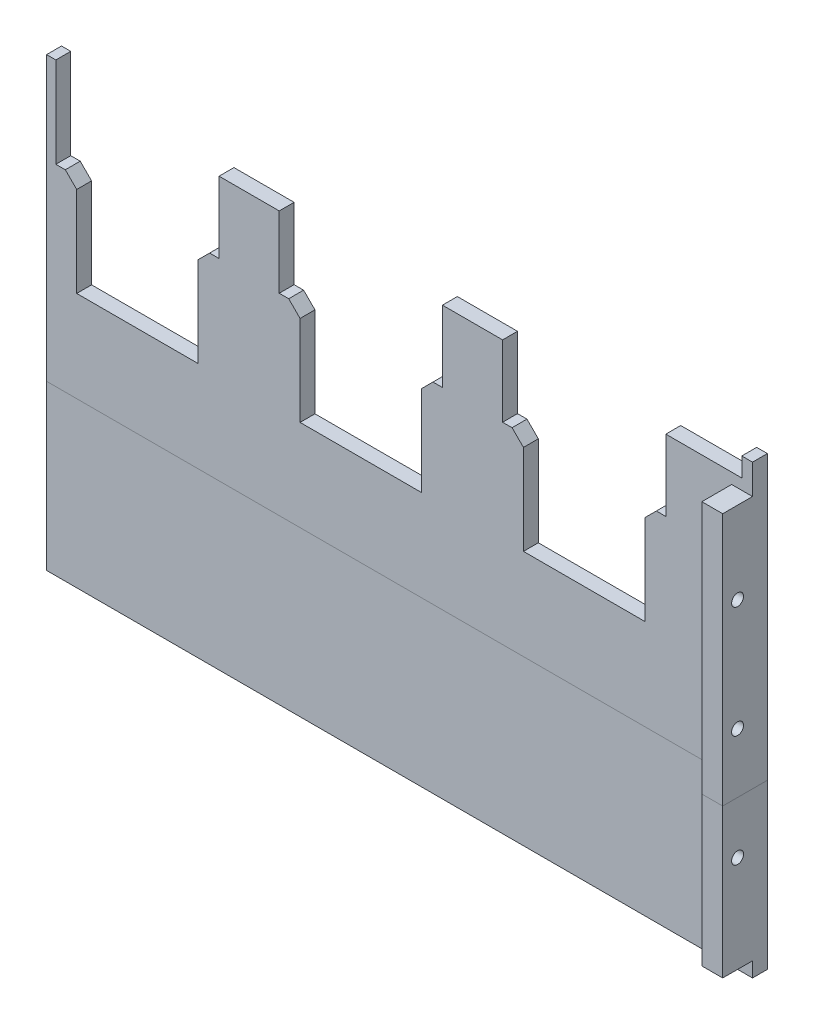
from build123d import *

# Parameters (mm, degrees)
SZKIC1_W                    = 237
SZKIC1_H                    = 150
DODANIE_WYCI_GNI_CIE1_DEPTH = 5
SZKIC2_W                    = 7
SZKIC2_H                    = 135
DODANIE_WYCI_GNI_CIE2_DEPTH = 10
OTW_R_4_0_4_1_D             = 4
OTW_R_4_0_4_1_DEPTH         = 6.7
WYTNIJ_WYCI_GNI_CIE1_REACH  = 143.04
SZKIC7_W                    = 2
SZKIC7_H                    = 6.7


with BuildPart() as part:
    # Szkic1 → Dodanie-wyciągnięcie1 (new body)
    with BuildSketch(Plane.XY):
        Rectangle(SZKIC1_W, SZKIC1_H)
    extrude(amount=DODANIE_WYCI_GNI_CIE1_DEPTH)

    # Szkic2 → Dodanie-wyciągnięcie2 (add)
    with BuildSketch(Plane.XY.offset(5)):
        with Locations((115, -2.5)):
            Rectangle(SZKIC2_W, SZKIC2_H)
    extrude(amount=DODANIE_WYCI_GNI_CIE2_DEPTH)

    # Otwór Ø4.0 (4)1
    with Locations(Plane(origin=(118.5, 0, 0), x_dir=(0, 0, -1), z_dir=(1, 0, 0))):
        with Locations((-10, -37.5), (-10, 37.5), (-10, 0)):
            Hole(OTW_R_4_0_4_1_D / 2, depth=OTW_R_4_0_4_1_DEPTH)

    # Szkic5 → Wytnij-wyciągnięcie1 (cut, up to next)
    with BuildSketch(Plane(origin=(0, 0, 0), x_dir=(-1, 0, 0), z_dir=(0, 0, -1)), mode=Mode.PRIVATE) as wytnij_wyci_gni_cie1_sk1:
        Polygon((-82.4, 10.6), (-41.6, 10.6), (-41.6, 40.834314575), (-38.717157288, 43.717157288), (-37.779678569, 44.654636006), (-34.6, 44.654636006), (-34.6, 65), (-34.6, 68.6), (-14.4, 68.6), (-14.4, 65), (-14.4, 44.654636006), (-11.220321431, 44.654636006), (-10.282842712, 43.717157288), (-7.4, 40.834314575), (-7.4, 10.6), (33.4, 10.6), (33.4, 40.834314575), (36.282842712, 43.717157288), (37.220321431, 44.654636006), (40.4, 44.654636006), (40.4, 65), (40.4, 68.6), (60.6, 68.6), (60.6, 65), (60.6, 44.654636006), (63.779678569, 44.654636006), (64.717157288, 43.717157288), (67.6, 40.834314575), (67.6, 10.6), (108.4, 10.6), (108.4, 40.834314575), (111.282842712, 43.717157288), (112.220321431, 44.654636006), (115.4, 44.654636006), (115.4, 65), (115.4, 75.4), (65.5, 75.4), (35.5, 75.4), (-9.5, 75.4), (-39.5, 75.4), (-84.5, 75.4), (-114.9, 75.4), (-114.9, 68.6), (-89.4, 68.6), (-89.4, 65), (-89.4, 44.654636006), (-86.220321431, 44.654636006), (-85.282842712, 43.717157288), (-82.4, 40.834314575), align=None)
        Polygon((-86, 45.054636006), (-86, 45), (-85, 44), (-82, 41), (-82, 11), (-42, 11), (-42, 41), (-39, 44), (-38, 45), (-38, 45.054636006), (-35, 45.054636006), (-35, 65), (-35, 69), (-14, 69), (-14, 65), (-14, 45.054636006), (-11, 45.054636006), (-11, 45), (-10, 44), (-7, 41), (-7, 11), (33, 11), (33, 41), (36, 44), (37, 45), (37, 45.054636006), (40, 45.054636006), (40, 65), (40, 69), (61, 69), (61, 65), (61, 45.054636006), (64, 45.054636006), (64, 45), (65, 44), (68, 41), (68, 11), (108, 11), (108, 41), (111, 44), (112, 45), (112, 45.054636006), (115, 45.054636006), (115, 65), (115, 75), (65.5, 75), (35.5, 75), (-9.5, 75), (-39.5, 75), (-84.5, 75), (-114.5, 75), (-114.5, 69), (-89, 69), (-89, 65), (-89, 45.054636006), align=None, mode=Mode.SUBTRACT)
    wytnij_wyci_gni_cie1_tool1 = extrude(wytnij_wyci_gni_cie1_sk1.sketch, amount=-WYTNIJ_WYCI_GNI_CIE1_REACH, mode=Mode.PRIVATE) & part.part
    add(wytnij_wyci_gni_cie1_tool1.solids().sort_by_distance((62, 10.839243, 0))[0], mode=Mode.SUBTRACT)


with BuildPart() as wytnij_wyci_gni_cie1_kept_piece:
    # of the separate pieces the step leaves, the one the design keeps (wytnij_wyci_gni_cie1_pieces_kept)
    add(part.part.solids().sort_by_distance((-118.5, -75, 0))[0])


with BuildPart() as body_2:
    # Podziel1: the piece on the far side of the plane
    add(wytnij_wyci_gni_cie1_kept_piece.part)
    split(bisect_by=Plane(origin=(0, -20, 0), x_dir=(0, 0, -1), z_dir=(0, -1, 0)), keep=Keep.BOTTOM)


with BuildPart() as wytnij_wyci_gni_cie1_kept_piece_1:
    add(wytnij_wyci_gni_cie1_kept_piece.part)

    # Podziel1
    split(bisect_by=Plane(origin=(0, -20, 0), x_dir=(0, 0, -1), z_dir=(0, -1, 0)), keep=Keep.TOP)

    # Szkic7 → Otwory ustalające Ø4.0mm1 (revolve, cut)
    with BuildSketch(Plane(origin=(115, -70, 10), x_dir=(0, 0, -1), z_dir=(1, 0, 0))):
        with Locations((1, 3.35)):
            Rectangle(SZKIC7_W, SZKIC7_H)
    revolve(axis=Axis((115, -76.35, 10), (0, 1, 0)), mode=Mode.SUBTRACT)


solid = Compound([body_2.part, wytnij_wyci_gni_cie1_kept_piece_1.part])
